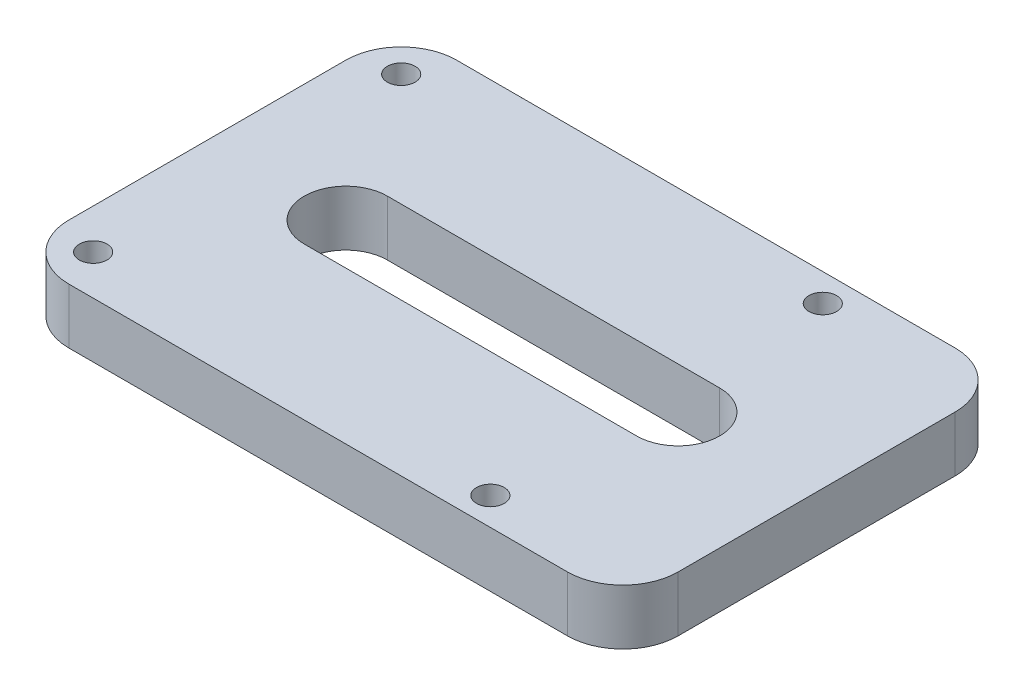
from build123d import *

# Parameters (mm, degrees)
SKETCH1_R           = 2.5
BOSS_EXTRUDE1_DEPTH = 10


with BuildPart() as part:
    # Sketch1 → Boss-Extrude1 (new body)
    with BuildSketch(Plane(origin=(0, 0, 0), x_dir=(1, 0, 0), z_dir=(0, 1, 0))):
        with BuildLine():
            Line((-45, -35), (45, -35))
            ThreePointArc((45, -35), (52.071067812, -32.071067812), (55, -25))
            Line((55, -25), (55, 25))
            ThreePointArc((55, 25), (52.071067812, 32.071067812), (45, 35))
            Line((45, 35), (-45, 35))
            ThreePointArc((-45, 35), (-52.071067812, 32.071067812), (-55, 25))
            Line((-55, 25), (-55, -25))
            ThreePointArc((-55, -25), (-52.071067812, -32.071067812), (-45, -35))
        make_face()
        with Locations(Location((-47.8, 27.8, 0), (0, 0, 270))):
            Circle(SKETCH1_R, mode=Mode.SUBTRACT)
        with Locations(Location((-47.8, -27.8, 0), (0, 0, 90))):
            Circle(SKETCH1_R, mode=Mode.SUBTRACT)
        with Locations(Location((26.1, 30, 0), (0, 0, 270))):
            Circle(SKETCH1_R, mode=Mode.SUBTRACT)
        with Locations(Location((26.1, -30, 0), (0, 0, 90))):
            Circle(SKETCH1_R, mode=Mode.SUBTRACT)
        with BuildLine():
            Line((-30, 7.5), (30, 7.5))
            ThreePointArc((30, 7.5), (37.5, 0), (30, -7.5))
            Line((30, -7.5), (-30, -7.5))
            ThreePointArc((-30, -7.5), (-37.5, 0), (-30, 7.5))
        make_face(mode=Mode.SUBTRACT)
    extrude(amount=BOSS_EXTRUDE1_DEPTH)


solid = part.part
